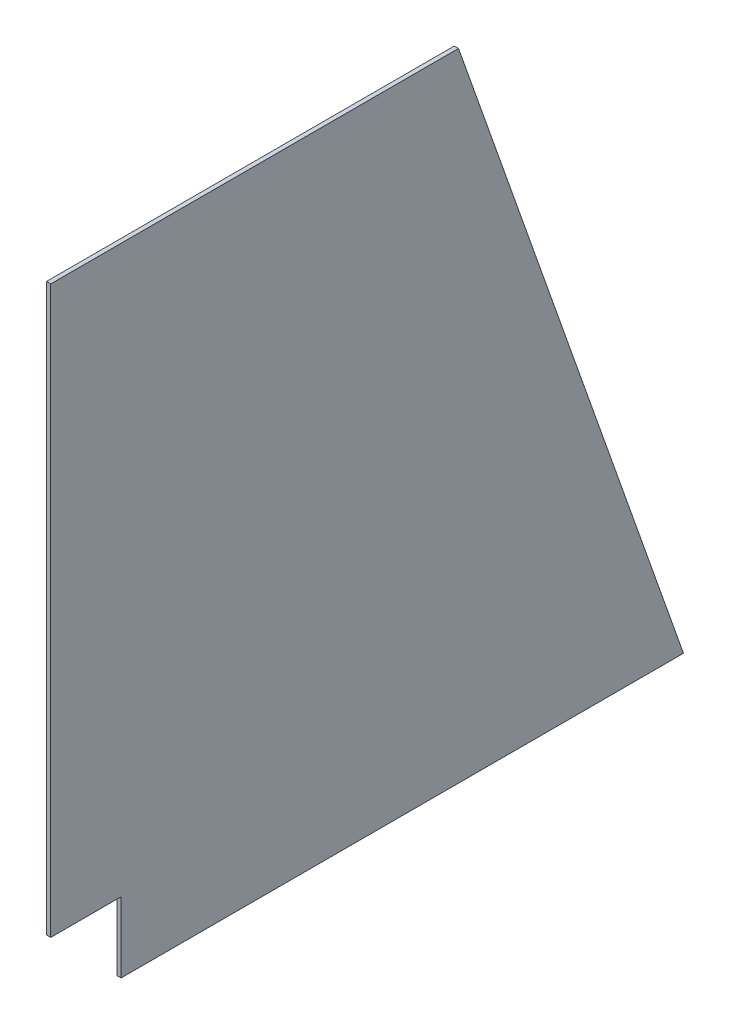
from build123d import *

# Parameters (mm, degrees)
BOSS_EXTRUDE1_DEPTH = 3
SKETCH2_W           = 50
SKETCH2_H           = 50
CUT_EXTRUDE1_DEPTH  = 10


with BuildPart() as part:
    # Sketch1 → Boss-Extrude1 (new body)
    with BuildSketch(Plane(origin=(0, 0, 0), x_dir=(0, 0, -1), z_dir=(1, 0, 0))):
        Polygon((31.669668796, 625.573683549), (191.669668796, 173.025343589), (-258.330331204, 173.025343589), (-258.330331204, 625.573683549), align=None)
    extrude(amount=BOSS_EXTRUDE1_DEPTH)

    # Sketch2 → Cut-Extrude1 (cut)
    with BuildSketch(Plane.ZY):
        with Locations((233.330331204, 198.025343589)):
            Rectangle(SKETCH2_W, SKETCH2_H)
    extrude(amount=-CUT_EXTRUDE1_DEPTH, mode=Mode.SUBTRACT)


solid = part.part
